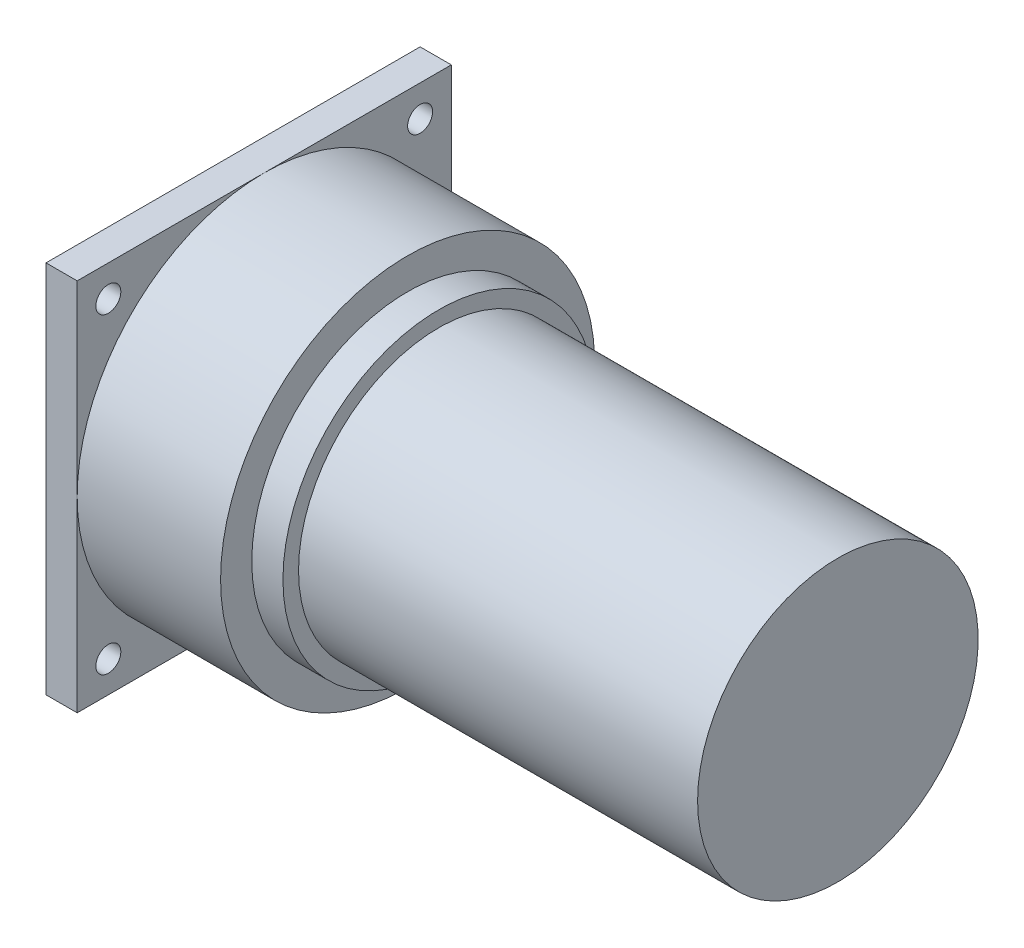
from build123d import *

# Parameters (mm, degrees)
SKETCH2_W           = 60
SKETCH2_H           = 60
SKETCH2_R           = 2
BOSS_EXTRUDE1_DEPTH = 5


with BuildPart() as part:
    # Sketch1 → Revolve1 (revolve)
    with BuildSketch(Plane(origin=(0, 0, 0), x_dir=(1, 0, 0), z_dir=(0, 1, 0)), mode=Mode.PRIVATE) as revolve1_sk:
        Polygon((0, 0), (0, 4), (19, 4), (19, 12), (22, 12), (22, 30), (45, 30), (45, 25), (50, 25), (50, 22.5), (114, 22.5), (114, 0), align=None)
    revolve(revolve1_sk.sketch.rotate(Axis((0, 0, 0), (1, 0, 0)), 180), axis=Axis((0, 0, 0), (1, 0, 0)))

    # Sketch2 → Boss-Extrude1 (add)
    with BuildSketch(Plane.ZY.offset(-22)):
        Rectangle(SKETCH2_W, SKETCH2_H)
        with Locations((-25, 25)):
            Circle(SKETCH2_R, mode=Mode.SUBTRACT)
        with Locations((25, 25)):
            Circle(SKETCH2_R, mode=Mode.SUBTRACT)
        with Locations((25, -25)):
            Circle(SKETCH2_R, mode=Mode.SUBTRACT)
        with Locations((-25, -25)):
            Circle(SKETCH2_R, mode=Mode.SUBTRACT)
    extrude(amount=BOSS_EXTRUDE1_DEPTH)


solid = part.part
